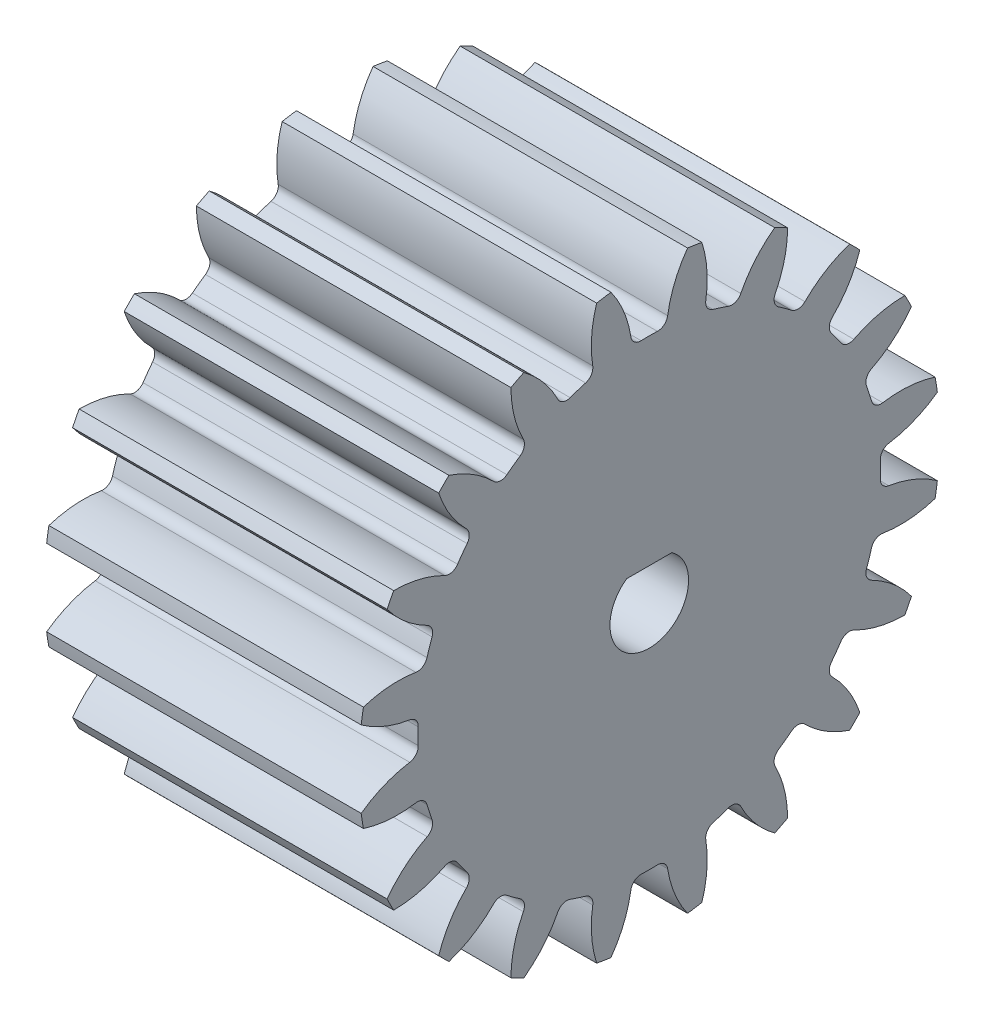
from build123d import *

# Parameters (mm, degrees)
SKETCH1_R                = 23.1
SKETCH1_R_2              = 3.125
BOSS_EXTRUDE2_DEPTH      = 25
CUT_EXTRUDE1_DEPTH       = 42.136601707
FILLET1_R                = 0.798
CIRPATTERN2_COUNT        = 20
FILLET1_OF_CIRPATTERN2_R = 0.798
BOSS_EXTRUDE3_DEPTH      = 25


with BuildPart() as part:
    # Sketch1 → Boss-Extrude2 (new body)
    with BuildSketch(Plane(origin=(0, 0, 0), x_dir=(0, 0, -1), z_dir=(1, 0, 0))):
        Circle(SKETCH1_R)
        Circle(SKETCH1_R_2, mode=Mode.SUBTRACT)
    extrude(amount=BOSS_EXTRUDE2_DEPTH)

    # Sketch3 → Cut-Extrude1 (cut, through all)
    with BuildSketch(Plane(origin=(25, 0, 0), x_dir=(0, 0, -1), z_dir=(1, 0, 0))):
        with BuildLine():
            ThreePointArc((1.378476266, 18.32322101), (0, 18.375), (-1.378476266, 18.32322101))
            ThreePointArc((-1.378476266, 18.32322101), (-1.895764689, 20.72568755), (-3.043774492, 22.898590281))
            ThreePointArc((-3.043774492, 22.898590281), (0, 23.1), (3.043774492, 22.898590281))
            ThreePointArc((3.043774492, 22.898590281), (1.895764689, 20.72568755), (1.378476266, 18.32322101))
        make_face()
    cut_extrude1 = extrude(amount=-CUT_EXTRUDE1_DEPTH, mode=Mode.SUBTRACT)

    # Fillet1
    fillet1_edges = [part.edges().sort_by_distance(p)[0] for p in [
        (12.5, 18.32322101, 1.378476266),
        (12.5, 18.32322101, -1.378476266),
    ]]
    fillet(fillet1_edges, radius=FILLET1_R)

    # CirPattern2: Cut-Extrude1 ×20 about axis
    cirpattern2_axis = Axis((0, 0, 0), (1, 0, 0))
    for i in range(1, CIRPATTERN2_COUNT):
        add(cut_extrude1.rotate(cirpattern2_axis, i * 360 / CIRPATTERN2_COUNT), mode=Mode.SUBTRACT)

    # Fillet1 of CirPattern2
    fillet1_of_cirpattern2_edges = [part.edges().sort_by_distance(p)[0] for p in [
        (12.5, 17.000446148, 6.973195519),
        (12.5, 17.852391334, 4.351177848),
        (12.5, 14.013549169, 11.88532981),
        (12.5, 15.634045209, 9.654908358),
        (12.5, 9.654908358, 15.634045209),
        (12.5, 11.88532981, 14.013549169),
        (12.5, 4.351177848, 17.852391334),
        (12.5, 6.973195519, 17.000446148),
        (12.5, -1.378476266, 18.32322101),
        (12.5, 1.378476266, 18.32322101),
        (12.5, -6.973195519, 17.000446148),
        (12.5, -4.351177848, 17.852391334),
        (12.5, -11.88532981, 14.013549169),
        (12.5, -9.654908358, 15.634045209),
        (12.5, -15.634045209, 9.654908358),
        (12.5, -14.013549169, 11.88532981),
        (12.5, -17.852391334, 4.351177848),
        (12.5, -17.000446148, 6.973195519),
        (12.5, -18.32322101, -1.378476266),
        (12.5, -18.32322101, 1.378476266),
        (12.5, -17.000446148, -6.973195519),
        (12.5, -17.852391334, -4.351177848),
        (12.5, -14.013549169, -11.88532981),
        (12.5, -15.634045209, -9.654908358),
        (12.5, -9.654908358, -15.634045209),
        (12.5, -11.88532981, -14.013549169),
        (12.5, -4.351177848, -17.852391334),
        (12.5, -6.973195519, -17.000446148),
        (12.5, 1.378476266, -18.32322101),
        (12.5, -1.378476266, -18.32322101),
        (12.5, 6.973195519, -17.000446148),
        (12.5, 4.351177848, -17.852391334),
        (12.5, 11.88532981, -14.013549169),
        (12.5, 9.654908358, -15.634045209),
        (12.5, 15.634045209, -9.654908358),
        (12.5, 14.013549169, -11.88532981),
        (12.5, 17.852391334, -4.351177848),
        (12.5, 17.000446148, -6.973195519),
    ]]
    fillet(fillet1_of_cirpattern2_edges, radius=FILLET1_OF_CIRPATTERN2_R)

    # Sketch4 → Boss-Extrude3 (add)
    with BuildSketch(Plane.ZY):
        with BuildLine():
            Line((-1.8, 2.55453029), (1.8, 2.55453029))
            ThreePointArc((1.8, 2.55453029), (0, 3.15453029), (-1.8, 2.55453029))
        make_face()
    extrude(amount=-BOSS_EXTRUDE3_DEPTH)


solid = part.part
